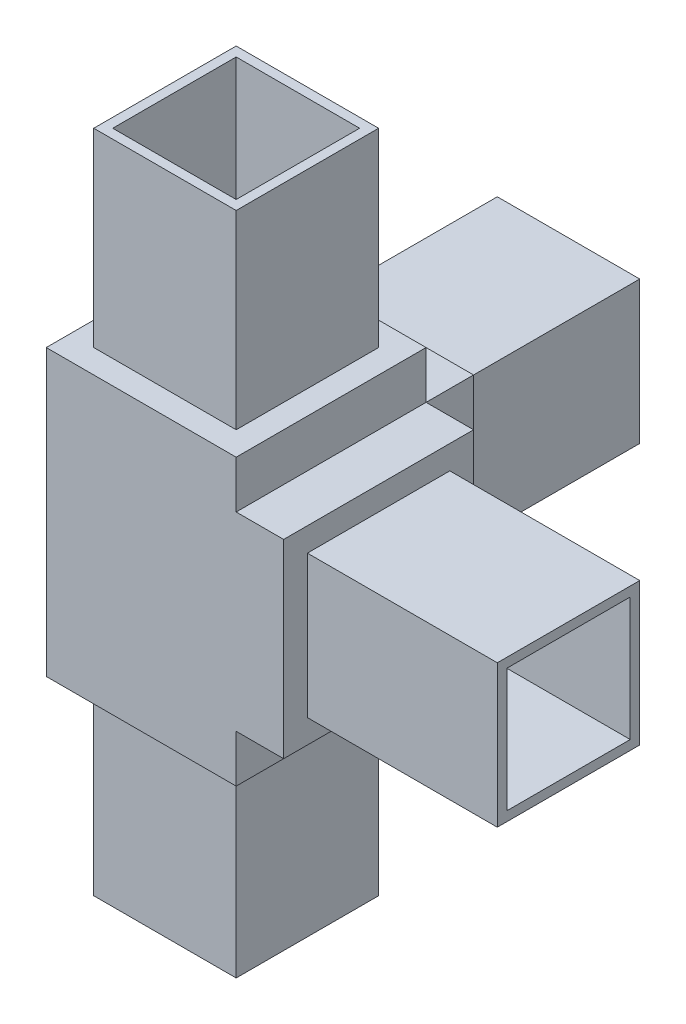
from build123d import *

# Parameters (mm, degrees)
CROQUIS1_W     = 40
CROQUIS1_H     = 50
CROQUIS1_H_2   = 40
CROQUIS1_W_2   = 50
EXTRUIR1_DEPTH = 40
CROQUIS5_W     = 40
CROQUIS5_H     = 40
EXTRUIR4_DEPTH = 50
CROQUIS8_W     = 40
CROQUIS8_H     = 40
EXTRUIR6_DEPTH = 50
CROQUIS9_W     = 40
CROQUIS9_H     = 40
CROQUIS9_W_2   = 30
CROQUIS9_H_2   = 30
EXTRUIR7_DEPTH = 40
CROQUIS2_W     = 40
CROQUIS2_H     = 40
CROQUIS2_W_2   = 30
CROQUIS2_H_2   = 30
EXTRUIR2_DEPTH = 40
CROQUIS3_W     = 40
CROQUIS3_H     = 40
CROQUIS3_W_2   = 30
CROQUIS3_H_2   = 30
EXTRUIR3_DEPTH = 40
CROQUIS7_W     = 40
CROQUIS7_H     = 40
CROQUIS7_W_2   = 30
CROQUIS7_H_2   = 30
EXTRUIR5_DEPTH = 40
VACIADO1_T     = -2


with BuildPart() as part:
    # Croquis1 → Extruir1 (new body)
    with BuildSketch(Plane(origin=(0, 0, 0), x_dir=(1, 0, 0), z_dir=(0, 1, 0))):
        with Locations((0, 45)):
            Rectangle(CROQUIS1_W, CROQUIS1_H)
        Rectangle(CROQUIS1_W, CROQUIS1_H_2)
        with Locations((45, 0)):
            Rectangle(CROQUIS1_W_2, CROQUIS1_H_2)
    extrude(amount=EXTRUIR1_DEPTH)

    # Croquis5 → Extruir4 (add)
    with BuildSketch(Plane.XZ):
        Rectangle(CROQUIS5_W, CROQUIS5_H)
    extrude(amount=EXTRUIR4_DEPTH)

    # Croquis8 → Extruir6 (add)
    with BuildSketch(Plane(origin=(0, 40, 0), x_dir=(1, 0, 0), z_dir=(0, 1, 0))):
        Rectangle(CROQUIS8_W, CROQUIS8_H)
    extrude(amount=EXTRUIR6_DEPTH)

    # Croquis9 → Extruir7 (cut)
    with BuildSketch(Plane(origin=(0, 90, 0), x_dir=(1, 0, 0), z_dir=(0, 1, 0))):
        Rectangle(CROQUIS9_W, CROQUIS9_H)
        Rectangle(CROQUIS9_W_2, CROQUIS9_H_2, mode=Mode.SUBTRACT)
    extrude(amount=-EXTRUIR7_DEPTH, mode=Mode.SUBTRACT)

    # Croquis2 → Extruir2 (cut)
    with BuildSketch(Plane(origin=(70, 0, 0), x_dir=(0, 0, -1), z_dir=(1, 0, 0))):
        with Locations((0, 20)):
            Rectangle(CROQUIS2_W, CROQUIS2_H)
        with Locations((0, 20)):
            Rectangle(CROQUIS2_W_2, CROQUIS2_H_2, mode=Mode.SUBTRACT)
    extrude(amount=-EXTRUIR2_DEPTH, mode=Mode.SUBTRACT)

    # Croquis3 → Extruir3 (cut)
    with BuildSketch(Plane(origin=(0, 0, -70), x_dir=(-1, 0, 0), z_dir=(0, 0, -1))):
        with Locations((0, 20)):
            Rectangle(CROQUIS3_W, CROQUIS3_H)
        with Locations((0, 20)):
            Rectangle(CROQUIS3_W_2, CROQUIS3_H_2, mode=Mode.SUBTRACT)
    extrude(amount=-EXTRUIR3_DEPTH, mode=Mode.SUBTRACT)

    # Croquis7 → Extruir5 (cut)
    with BuildSketch(Plane.XZ.offset(50)):
        Rectangle(CROQUIS7_W, CROQUIS7_H)
        Rectangle(CROQUIS7_W_2, CROQUIS7_H_2, mode=Mode.SUBTRACT)
    extrude(amount=-EXTRUIR5_DEPTH, mode=Mode.SUBTRACT)

    # Vaciado1
    vaciado1_openings = [part.faces().sort_by_distance(p)[0] for p in [
        (0, 20, -70),
        (0, -50, 0),
        (0, 90, 0),
        (70, 20, 0),
    ]]
    offset(amount=VACIADO1_T, openings=vaciado1_openings, kind=Kind.INTERSECTION)


solid = part.part
